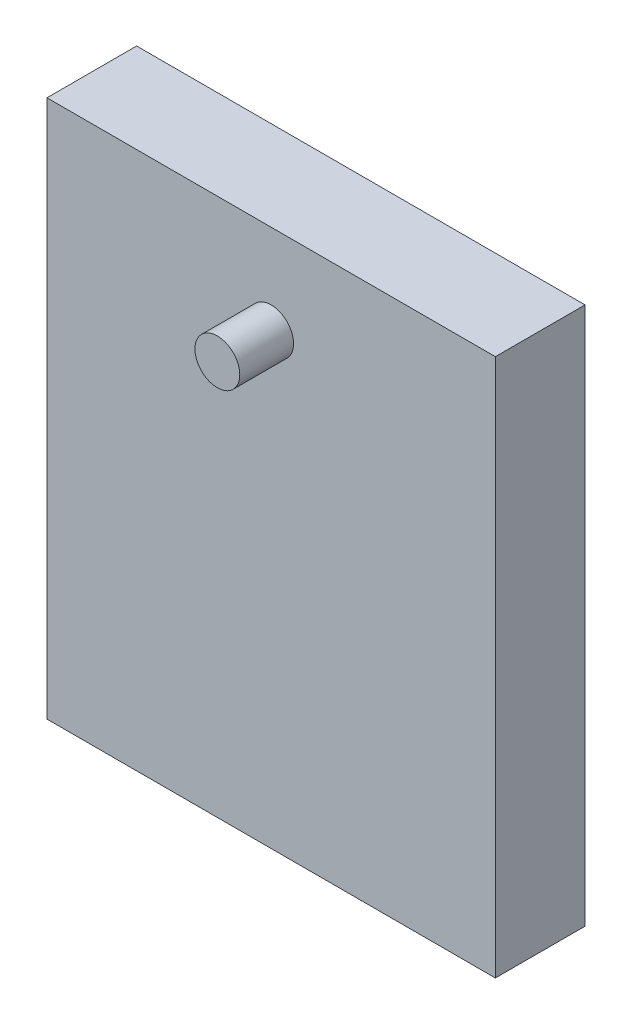
from build123d import *

# Parameters (mm, degrees)
ESQUISSE1_W        = 50
ESQUISSE1_H        = 60
BOSS_EXTRU_1_DEPTH = 10
ESQUISSE2_R        = 2.5
BOSS_EXTRU_2_DEPTH = 6


with BuildPart() as part:
    # Esquisse1 → Boss.-Extru.1 (new body)
    with BuildSketch(Plane.XY):
        with Locations((-5.644407926, 11.501525822)):
            Rectangle(ESQUISSE1_W, ESQUISSE1_H)
    extrude(amount=BOSS_EXTRU_1_DEPTH)

    # Esquisse2 → Boss.-Extru.2 (add)
    with BuildSketch(Plane.XY.offset(10)):
        with Locations((-5.644407926, 31.501525822)):
            Circle(ESQUISSE2_R)
    extrude(amount=BOSS_EXTRU_2_DEPTH)


solid = part.part
